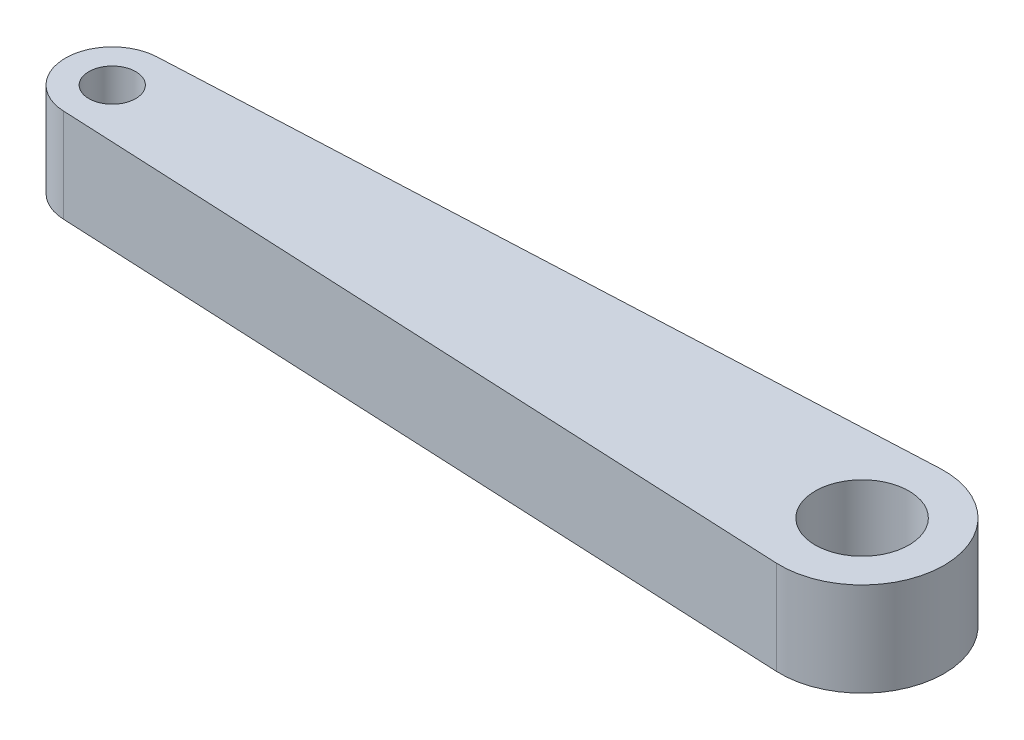
from build123d import *

# Parameters (mm, degrees)
SKETCH_1_R      = 1
SKETCH_1_R_2    = 2
EXTRUDE_1_DEPTH = 4


with BuildPart() as part:
    # 草图1 → 凸台-拉伸1 (new body)
    with BuildSketch(Plane(origin=(0, 0, 0), x_dir=(1, 0, 0), z_dir=(0, 1, 0))):
        with BuildLine():
            Line((-0.09375, 1.997801526), (31.8359375, 3.496152671))
            ThreePointArc((31.8359375, 3.496152671), (35.5, 0), (31.8359375, -3.496152671))
            Line((31.8359375, -3.496152671), (-0.09375, -1.997801526))
            ThreePointArc((-0.09375, -1.997801526), (-2, 0), (-0.09375, 1.997801526))
        make_face()
        with Locations(Location((0, 0, 0), (0, 0, 270))):
            Circle(SKETCH_1_R, mode=Mode.SUBTRACT)
        with Locations(Location((32, 0, 0), (0, 0, 270))):
            Circle(SKETCH_1_R_2, mode=Mode.SUBTRACT)
    extrude(amount=EXTRUDE_1_DEPTH)


solid = part.part
